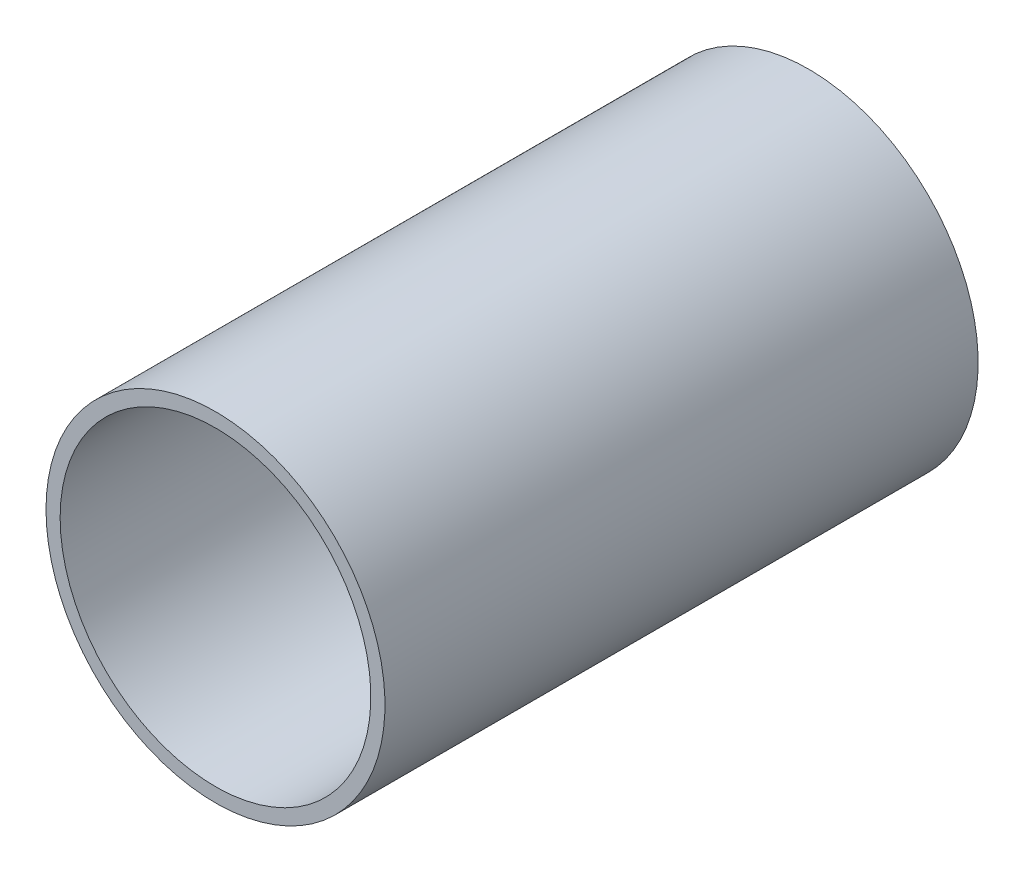
from build123d import *

# Parameters (mm, degrees)
SKETCH1_R           = 12
SKETCH1_R_2         = 11
BOSS_EXTRUDE1_DEPTH = 21


with BuildPart() as part:
    # Sketch1 → Boss-Extrude1 (new, symmetric)
    with BuildSketch(Plane.XY):
        with Locations(Location((0, 0, 0), (0, 0, 180))):
            Circle(SKETCH1_R)
        with Locations(Location((0, 0, 0), (0, 0, 180))):
            Circle(SKETCH1_R_2, mode=Mode.SUBTRACT)
    extrude(amount=BOSS_EXTRUDE1_DEPTH, both=True)


solid = part.part
